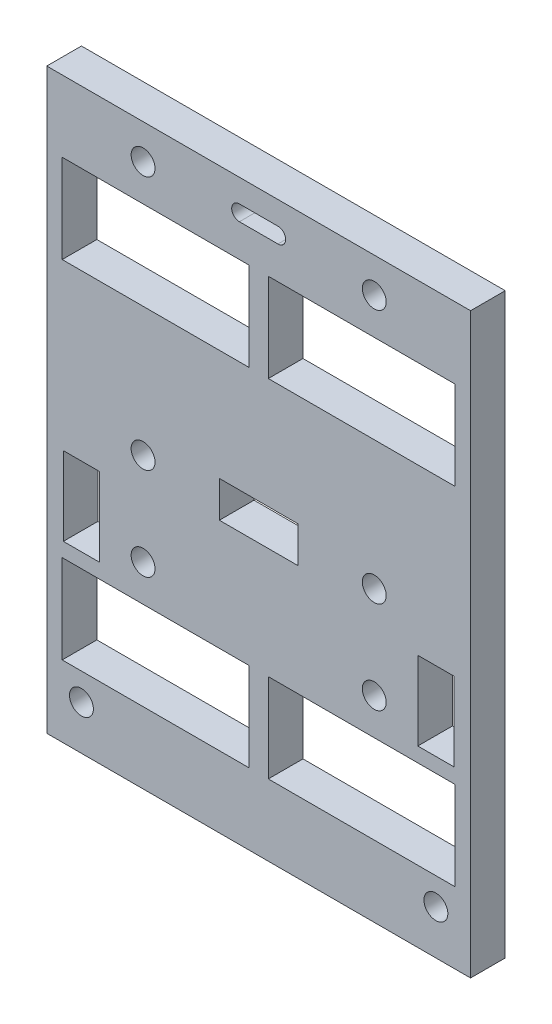
from build123d import *

# Parameters (mm, degrees)
SKETCH1_W                 = 55
SKETCH1_H                 = 75
SKETCH1_W_2               = 24.25
SKETCH1_H_2               = 11.5
BOSS_EXTRUDE1_DEPTH       = 4.5
SKETCH2_R                 = 1.55
SCREWHOLES_DEPTH          = 47.719910103
SKETCH4_W                 = 10.2
SKETCH4_H                 = 4.7
MOUNTINGPLATETAB_DEPTH    = 47.719910103
SKETCH5_R                 = 1.55
SKETCH5_W                 = 4.7
SKETCH5_H                 = 10.2
BRACETABS_DEPTH           = 47.719910103
SKETCH8_R                 = 1.55
EXPANSIONSCREWHOLES_DEPTH = 47.719910103
CABLETIESLOT_DEPTH        = 47.719910103


with BuildPart() as part:
    # Sketch1 → Boss-Extrude1 (new body)
    with BuildSketch(Plane.XY):
        Rectangle(SKETCH1_W, SKETCH1_H)
        with Locations((-13.375, 22.5)):
            Rectangle(SKETCH1_W_2, SKETCH1_H_2, mode=Mode.SUBTRACT)
        with Locations((13.375, 22.5)):
            Rectangle(SKETCH1_W_2, SKETCH1_H_2, mode=Mode.SUBTRACT)
        with Locations((13.375, -22.5)):
            Rectangle(SKETCH1_W_2, SKETCH1_H_2, mode=Mode.SUBTRACT)
        with Locations((-13.375, -22.5)):
            Rectangle(SKETCH1_W_2, SKETCH1_H_2, mode=Mode.SUBTRACT)
    extrude(amount=BOSS_EXTRUDE1_DEPTH)

    # Sketch2 → screwHoles (cut, through all)
    with BuildSketch(Plane.XY.offset(4.5)):
        with Locations((-15, 33)):
            Circle(SKETCH2_R)
        with Locations(Location((15, 33, 0), (0, 0, 180))):
            Circle(SKETCH2_R)
        with Locations((15, 0)):
            Circle(SKETCH2_R)
        with Locations(Location((-15, 0, 0), (0, 0, 180))):
            Circle(SKETCH2_R)
    extrude(amount=-SCREWHOLES_DEPTH, mode=Mode.SUBTRACT)

    # Sketch4 → mountingPlateTab (cut, through all)
    with BuildSketch(Plane.XY.offset(4.5)):
        Rectangle(SKETCH4_W, SKETCH4_H)
    extrude(amount=-MOUNTINGPLATETAB_DEPTH, mode=Mode.SUBTRACT)

    # Sketch5 → BraceTabs (cut, through all)
    with BuildSketch(Plane.XY.offset(4.5)):
        with Locations((23, -31.75)):
            Circle(SKETCH5_R)
        with Locations(Location((-23, -31.75, 0), (0, 0, 180))):
            Circle(SKETCH5_R)
        with Locations((23, -9.75)):
            Rectangle(SKETCH5_W, SKETCH5_H)
        with Locations((-23, -9.75)):
            Rectangle(SKETCH5_W, SKETCH5_H)
    extrude(amount=-BRACETABS_DEPTH, mode=Mode.SUBTRACT)

    # Sketch8 → ExpansionScrewholes (cut, through all)
    with BuildSketch(Plane.XY.offset(4.5)):
        with Locations((-15, -12)):
            Circle(SKETCH8_R)
        with Locations(Location((15, -12, 0), (0, 0, 180))):
            Circle(SKETCH8_R)
    extrude(amount=-EXPANSIONSCREWHOLES_DEPTH, mode=Mode.SUBTRACT)

    # Sketch12 → CableTieSlot (cut, through all)
    with BuildSketch(Plane.XY.offset(4.5)):
        with BuildLine():
            Line((-2.5, 34.5), (2.5, 34.5))
            ThreePointArc((2.5, 34.5), (3.5, 33.5), (2.5, 32.5))
            Line((2.5, 32.5), (-2.5, 32.5))
            ThreePointArc((-2.5, 32.5), (-3.5, 33.5), (-2.5, 34.5))
        make_face()
    extrude(amount=-CABLETIESLOT_DEPTH, mode=Mode.SUBTRACT)


solid = part.part
